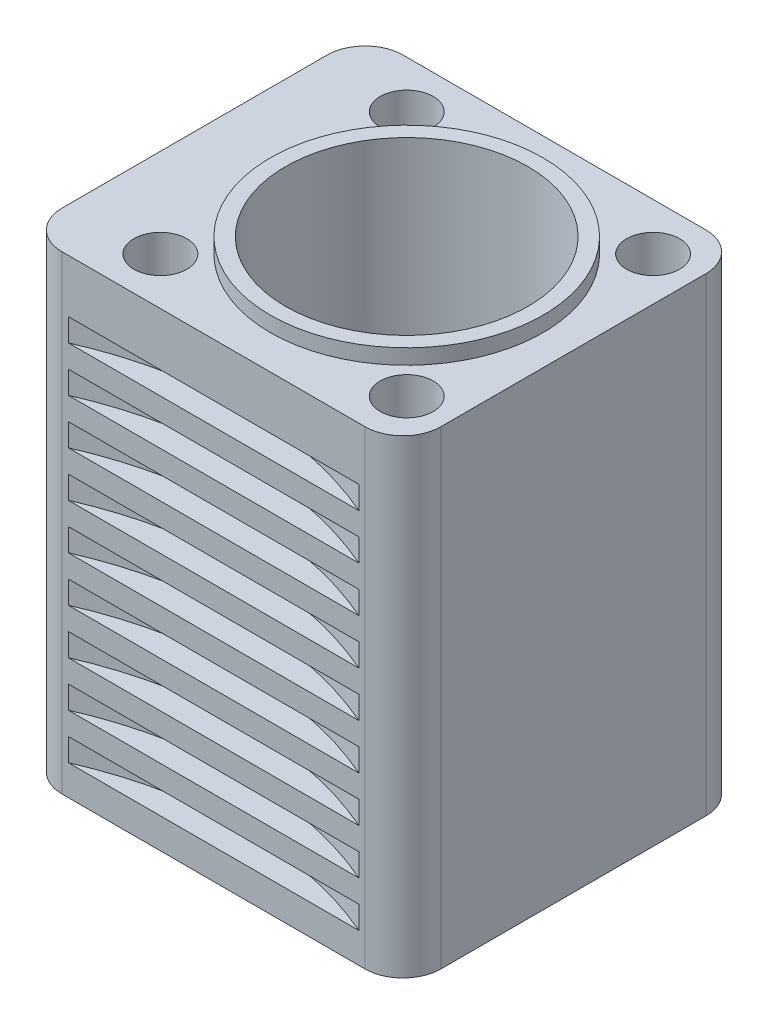
from build123d import *

# Parameters (mm, degrees)
BOSS_EXTRUDE1_DEPTH     = 62
SKETCH2_R               = 18
BOSS_EXTRUDE2_DEPTH     = 2
SKETCH3_R               = 16
CUT_EXTRUDE1_DEPTH      = 74.391075752
CUT_EXTRUDE2_DEPTH      = 2
SKETCH5_R               = 3.5
CUT_EXTRUDE3_DEPTH      = 74.391075752
SKETCH6_W               = 48
SKETCH6_H               = 3
LPATTERN1_COUNT         = 9
LPATTERN1_PITCH         = 6
MIRROR1_COPY_1_SKETCH_W = 48
MIRROR1_COPY_1_SKETCH_H = 3
MIRROR1_COPY_2_SKETCH_W = 48
MIRROR1_COPY_2_SKETCH_H = 3
MIRROR1_COPY_3_SKETCH_W = 48
MIRROR1_COPY_3_SKETCH_H = 3
MIRROR1_COPY_4_SKETCH_W = 48
MIRROR1_COPY_4_SKETCH_H = 3
MIRROR1_COPY_5_SKETCH_W = 48
MIRROR1_COPY_5_SKETCH_H = 3
MIRROR1_COPY_6_SKETCH_W = 48
MIRROR1_COPY_6_SKETCH_H = 3
MIRROR1_COPY_7_SKETCH_W = 48
MIRROR1_COPY_7_SKETCH_H = 3
MIRROR1_COPY_8_SKETCH_W = 48
MIRROR1_COPY_8_SKETCH_H = 3
SKETCH8_W               = 48
SKETCH8_H               = 3
LPATTERN2_COUNT         = 9
LPATTERN2_PITCH         = 6


with BuildPart() as part:
    # Sketch1 → Boss-Extrude1 (new body)
    with BuildSketch(Plane(origin=(0, 0, 0), x_dir=(1, 0, 0), z_dir=(0, 1, 0))):
        with BuildLine():
            Line((-23, 22.5), (17, 22.5))
            ThreePointArc((17, 22.5), (20.535533906, 21.035533906), (22, 17.5))
            Line((22, 17.5), (22, -17.5))
            ThreePointArc((22, -17.5), (20.535533906, -21.035533906), (17, -22.5))
            Line((17, -22.5), (-23, -22.5))
            ThreePointArc((-23, -22.5), (-26.535533906, -21.035533906), (-28, -17.5))
            Line((-28, -17.5), (-28, 17.5))
            ThreePointArc((-28, 17.5), (-26.535533906, 21.035533906), (-23, 22.5))
        make_face()
    extrude(amount=BOSS_EXTRUDE1_DEPTH)

    # Sketch2 → Boss-Extrude2 (add)
    with BuildSketch(Plane(origin=(0, 62, 0), x_dir=(1, 0, 0), z_dir=(0, 1, 0))):
        with Locations(Location((0, 0, 0), (0, 0, 270))):
            Circle(SKETCH2_R)
    extrude(amount=BOSS_EXTRUDE2_DEPTH)

    # Sketch3 → Cut-Extrude1 (cut, through all)
    with BuildSketch(Plane(origin=(0, 64, 0), x_dir=(1, 0, 0), z_dir=(0, 1, 0))):
        with Locations(Location((0, 0, 0), (0, 0, 270))):
            Circle(SKETCH3_R)
    extrude(amount=-CUT_EXTRUDE1_DEPTH, mode=Mode.SUBTRACT)

    # Sketch4 → Cut-Extrude2 (cut)
    with BuildSketch(Plane.XZ):
        with BuildLine():
            Line((-22.61, 2), (-8.699965398, 2))
            Line((-8.699965398, 2), (-8.699965398, -2))
            Line((-8.699965398, -2), (-22.61, -2))
            ThreePointArc((-22.61, -2), (-24.61, 0), (-22.61, 2))
        make_face()
    extrude(amount=-CUT_EXTRUDE2_DEPTH, mode=Mode.SUBTRACT)

    # Sketch5 → Cut-Extrude3 (cut, through all)
    with BuildSketch(Plane.XZ):
        with Locations(Location((16.263455967, 16.263455967, 0), (0, 0, 270))):
            Circle(SKETCH5_R)
        with Locations(Location((16.263455967, -16.263455967, 0), (0, 0, 270))):
            Circle(SKETCH5_R)
        with Locations(Location((-16.263455967, -16.263455967, 0), (0, 0, 270))):
            Circle(SKETCH5_R)
        with Locations(Location((-16.263455967, 16.263455967, 0), (0, 0, 270))):
            Circle(SKETCH5_R)
    extrude(amount=-CUT_EXTRUDE3_DEPTH, mode=Mode.SUBTRACT)

    # Sketch6 → Cut-Revolve1 (revolve, cut)
    with BuildSketch(Plane(origin=(-3, 0, 0), x_dir=(0, 0, -1), z_dir=(1, 0, 0))):
        with Locations((-42.5, 5.5)):
            Rectangle(SKETCH6_W, SKETCH6_H)
    cut_revolve1 = revolve(axis=Axis((-3, 7, 66.5), (0, -1, 0)), mode=Mode.SUBTRACT)

    # LPattern1: Cut-Revolve1 ×9
    with Locations(*[(0, i * LPATTERN1_PITCH, 0) for i in range(1, LPATTERN1_COUNT)]):
        add(cut_revolve1, mode=Mode.SUBTRACT)

    # Mirror1: Cut-Revolve1 across plane
    add(cut_revolve1.mirror(Plane.XY), mode=Mode.SUBTRACT)

    # Mirror1 copy 1 sketch → Mirror1 copy 1 (revolve, cut)
    with BuildSketch(Plane(origin=(-3, 6, 0), x_dir=(0, 0, 1), z_dir=(1, 0, 0))):
        with Locations((-42.5, -5.5)):
            Rectangle(MIRROR1_COPY_1_SKETCH_W, MIRROR1_COPY_1_SKETCH_H)
    revolve(axis=Axis((-3, 13, -66.5), (0, 1, 0)), mode=Mode.SUBTRACT)

    # Mirror1 copy 2 sketch → Mirror1 copy 2 (revolve, cut)
    with BuildSketch(Plane(origin=(-3, 12, 0), x_dir=(0, 0, 1), z_dir=(1, 0, 0))):
        with Locations((-42.5, -5.5)):
            Rectangle(MIRROR1_COPY_2_SKETCH_W, MIRROR1_COPY_2_SKETCH_H)
    revolve(axis=Axis((-3, 19, -66.5), (0, 1, 0)), mode=Mode.SUBTRACT)

    # Mirror1 copy 3 sketch → Mirror1 copy 3 (revolve, cut)
    with BuildSketch(Plane(origin=(-3, 18, 0), x_dir=(0, 0, 1), z_dir=(1, 0, 0))):
        with Locations((-42.5, -5.5)):
            Rectangle(MIRROR1_COPY_3_SKETCH_W, MIRROR1_COPY_3_SKETCH_H)
    revolve(axis=Axis((-3, 25, -66.5), (0, 1, 0)), mode=Mode.SUBTRACT)

    # Mirror1 copy 4 sketch → Mirror1 copy 4 (revolve, cut)
    with BuildSketch(Plane(origin=(-3, 24, 0), x_dir=(0, 0, 1), z_dir=(1, 0, 0))):
        with Locations((-42.5, -5.5)):
            Rectangle(MIRROR1_COPY_4_SKETCH_W, MIRROR1_COPY_4_SKETCH_H)
    revolve(axis=Axis((-3, 31, -66.5), (0, 1, 0)), mode=Mode.SUBTRACT)

    # Mirror1 copy 5 sketch → Mirror1 copy 5 (revolve, cut)
    with BuildSketch(Plane(origin=(-3, 30, 0), x_dir=(0, 0, 1), z_dir=(1, 0, 0))):
        with Locations((-42.5, -5.5)):
            Rectangle(MIRROR1_COPY_5_SKETCH_W, MIRROR1_COPY_5_SKETCH_H)
    revolve(axis=Axis((-3, 37, -66.5), (0, 1, 0)), mode=Mode.SUBTRACT)

    # Mirror1 copy 6 sketch → Mirror1 copy 6 (revolve, cut)
    with BuildSketch(Plane(origin=(-3, 36, 0), x_dir=(0, 0, 1), z_dir=(1, 0, 0))):
        with Locations((-42.5, -5.5)):
            Rectangle(MIRROR1_COPY_6_SKETCH_W, MIRROR1_COPY_6_SKETCH_H)
    revolve(axis=Axis((-3, 43, -66.5), (0, 1, 0)), mode=Mode.SUBTRACT)

    # Mirror1 copy 7 sketch → Mirror1 copy 7 (revolve, cut)
    with BuildSketch(Plane(origin=(-3, 42, 0), x_dir=(0, 0, 1), z_dir=(1, 0, 0))):
        with Locations((-42.5, -5.5)):
            Rectangle(MIRROR1_COPY_7_SKETCH_W, MIRROR1_COPY_7_SKETCH_H)
    revolve(axis=Axis((-3, 49, -66.5), (0, 1, 0)), mode=Mode.SUBTRACT)

    # Mirror1 copy 8 sketch → Mirror1 copy 8 (revolve, cut)
    with BuildSketch(Plane(origin=(-3, 48, 0), x_dir=(0, 0, 1), z_dir=(1, 0, 0))):
        with Locations((-42.5, -5.5)):
            Rectangle(MIRROR1_COPY_8_SKETCH_W, MIRROR1_COPY_8_SKETCH_H)
    revolve(axis=Axis((-3, 55, -66.5), (0, 1, 0)), mode=Mode.SUBTRACT)

    # Sketch8 → Cut-Revolve3 (revolve, cut)
    with BuildSketch(Plane.XY):
        with Locations((-48, 5.5)):
            Rectangle(SKETCH8_W, SKETCH8_H)
    cut_revolve3 = revolve(axis=Axis((-72, 7, 0), (0, -1, 0)), mode=Mode.SUBTRACT)

    # LPattern2: Cut-Revolve3 ×9
    with Locations(*[(0, i * LPATTERN2_PITCH, 0) for i in range(1, LPATTERN2_COUNT)]):
        add(cut_revolve3, mode=Mode.SUBTRACT)


solid = part.part
